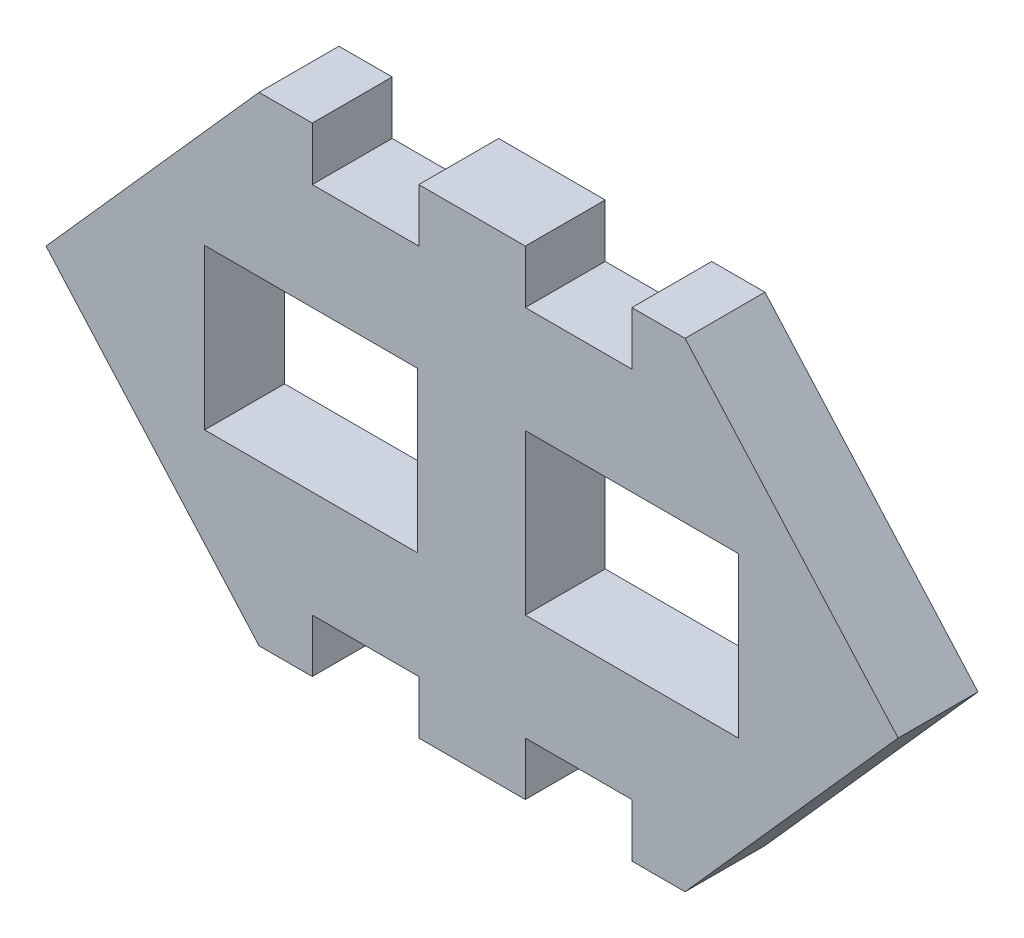
from build123d import *

# Parameters (mm, degrees)
SKETCH1_W           = 101.6
SKETCH1_H           = 76.2
BOSS_EXTRUDE1_DEPTH = 38.1


with BuildPart() as part:
    # Sketch1 → Boss-Extrude1 (new body)
    with BuildSketch(Plane.XY):
        Polygon((0, 0), (101.6, 114.3), (127, 114.3), (127, 88.9), (177.8, 88.9), (177.8, 114.3), (228.6, 114.3), (228.6, 88.9), (279.4, 88.9), (279.4, 114.3), (304.8, 114.3), (406.4, 0), (304.8, -114.3), (279.4, -114.3), (279.4, -88.9), (228.6, -88.9), (228.6, -114.3), (177.8, -114.3), (177.8, -88.9), (127, -88.9), (127, -114.3), (101.6, -114.3), align=None)
        with Locations((126.483076325, 0)):
            Rectangle(SKETCH1_W, SKETCH1_H, mode=Mode.SUBTRACT)
        with Locations((279.4, 0)):
            Rectangle(SKETCH1_W, SKETCH1_H, mode=Mode.SUBTRACT)
    extrude(amount=BOSS_EXTRUDE1_DEPTH)


solid = part.part
